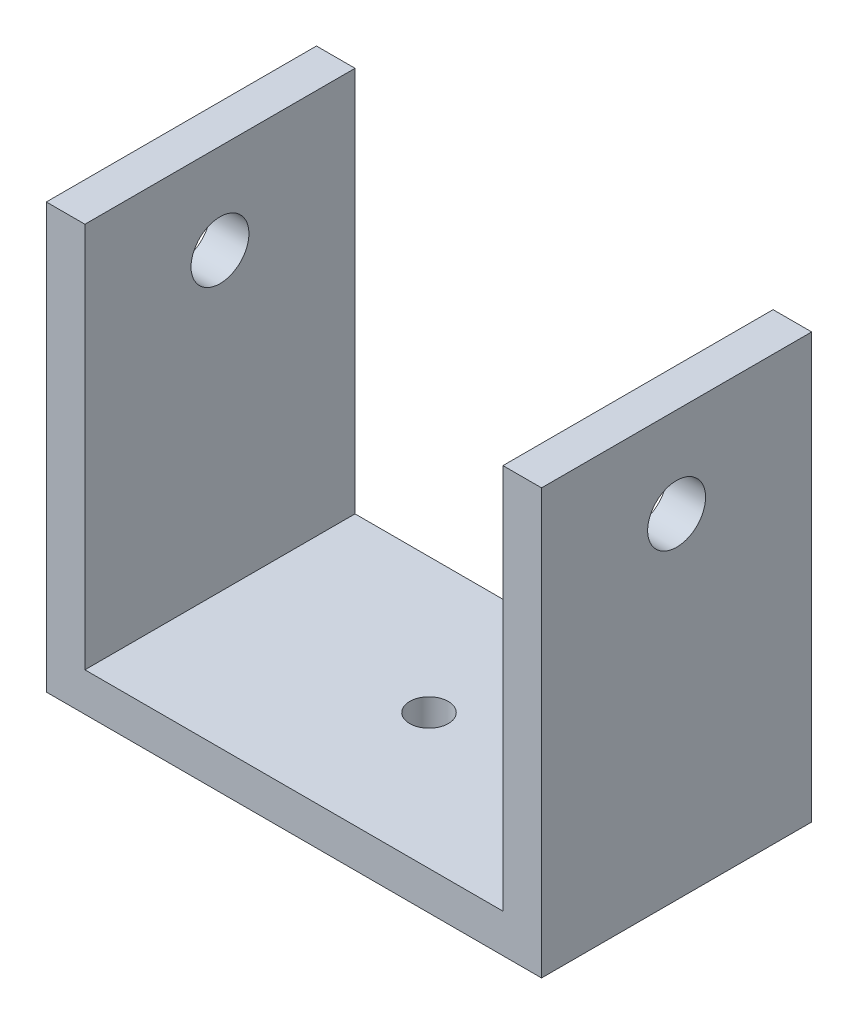
from build123d import *

# Parameters (mm, degrees)
SKETCH1_W           = 32.5
SKETCH1_H           = 21
BOSS_EXTRUDE1_DEPTH = 3
SKETCH1_3_W         = 3
SKETCH1_3_H         = 21
BOSS_EXTRUDE2_DEPTH = 33
SKETCH2_R           = 2.25
CUT_EXTRUDE1_DEPTH  = 52.783201909
SKETCH3_R           = 1.5
CUT_EXTRUDE2_DEPTH  = 38.159285515


with BuildPart() as part:
    # Sketch1 → Boss-Extrude1 (new body)
    with BuildSketch(Plane(origin=(0, 0, 0), x_dir=(1, 0, 0), z_dir=(0, 1, 0))):
        Rectangle(SKETCH1_W, SKETCH1_H)
    extrude(amount=BOSS_EXTRUDE1_DEPTH)

    # Sketch1<3> → Boss-Extrude2 (add)
    with BuildSketch(Plane(origin=(0, 0, 0), x_dir=(1, 0, 0), z_dir=(0, 1, 0))):
        with Locations((-17.75, 0)):
            Rectangle(SKETCH1_3_W, SKETCH1_3_H)
        with Locations((17.75, 0)):
            Rectangle(SKETCH1_3_W, SKETCH1_3_H)
    extrude(amount=BOSS_EXTRUDE2_DEPTH)

    # Sketch2 → Cut-Extrude1 (cut, through all)
    with BuildSketch(Plane(origin=(19.25, 0, 0), x_dir=(0, 0, -1), z_dir=(1, 0, 0))):
        with Locations((0, 26)):
            Circle(SKETCH2_R)
    extrude(amount=-CUT_EXTRUDE1_DEPTH, mode=Mode.SUBTRACT)

    # Sketch3 → Cut-Extrude2 (cut, through all)
    with BuildSketch(Plane(origin=(0, 3, 0), x_dir=(1, 0, 0), z_dir=(0, 1, 0))):
        Circle(SKETCH3_R)
    extrude(amount=-CUT_EXTRUDE2_DEPTH, mode=Mode.SUBTRACT)


solid = part.part
